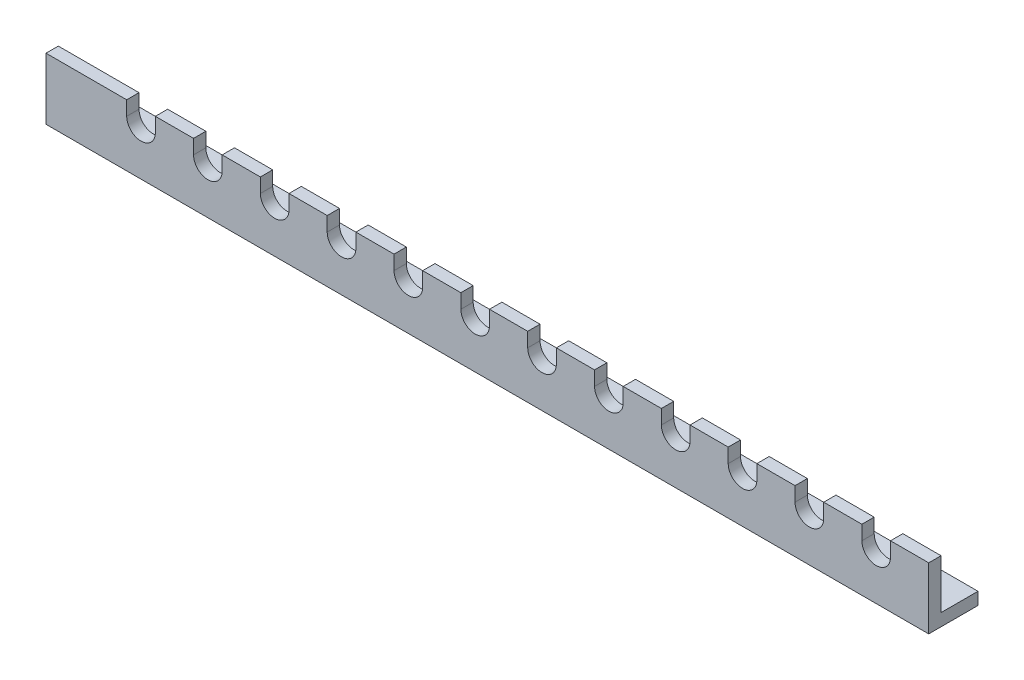
from build123d import *

# Parameters (mm, degrees)
BOSS_EXTRUDE1_DEPTH = 4
SKETCH3_W           = 286.6
SKETCH3_H           = 12
BOSS_EXTRUDE2_DEPTH = 4
CUT_EXTRUDE1_REACH  = 258.811
SKETCH4_R           = 1.55


with BuildPart() as part:
    # Sketch1 → Boss-Extrude1 (new body)
    with BuildSketch(Plane.XY):
        with BuildLine():
            Line((-4.65, 0), (-4.65, 4.65))
            Line((-4.65, 4.65), (-30.85, 4.65))
            Line((-30.85, 4.65), (-30.85, -15.35))
            Line((-30.85, -15.35), (255.75, -15.35))
            Line((255.75, -15.35), (255.75, 4.65))
            Line((255.75, 4.65), (243.35, 4.65))
            Line((243.35, 4.65), (243.35, 0))
            ThreePointArc((243.35, 0), (238.7, -4.65), (234.05, 0))
            Line((234.05, 0), (234.05, 4.65))
            Line((234.05, 4.65), (221.65, 4.65))
            Line((221.65, 4.65), (221.65, 0))
            ThreePointArc((221.65, 0), (217, -4.65), (212.35, 0))
            Line((212.35, 0), (212.35, 4.65))
            Line((212.35, 4.65), (199.95, 4.65))
            Line((199.95, 4.65), (199.95, 0))
            ThreePointArc((199.95, 0), (195.3, -4.65), (190.65, 0))
            Line((190.65, 0), (190.65, 4.65))
            Line((190.65, 4.65), (178.25, 4.65))
            Line((178.25, 4.65), (178.25, 0))
            ThreePointArc((178.25, 0), (173.6, -4.65), (168.95, 0))
            Line((168.95, 0), (168.95, 4.65))
            Line((168.95, 4.65), (156.55, 4.65))
            Line((156.55, 4.65), (156.55, 0))
            ThreePointArc((156.55, 0), (151.9, -4.65), (147.25, 0))
            Line((147.25, 0), (147.25, 4.65))
            Line((147.25, 4.65), (134.85, 4.65))
            Line((134.85, 4.65), (134.85, 0))
            ThreePointArc((134.85, 0), (130.2, -4.65), (125.55, 0))
            Line((125.55, 0), (125.55, 4.65))
            Line((125.55, 4.65), (113.15, 4.65))
            Line((113.15, 4.65), (113.15, 0))
            ThreePointArc((113.15, 0), (108.5, -4.65), (103.85, 0))
            Line((103.85, 0), (103.85, 4.65))
            Line((103.85, 4.65), (91.45, 4.65))
            Line((91.45, 4.65), (91.45, 0))
            ThreePointArc((91.45, 0), (86.8, -4.65), (82.15, 0))
            Line((82.15, 0), (82.15, 4.65))
            Line((82.15, 4.65), (69.75, 4.65))
            Line((69.75, 4.65), (69.75, 0))
            ThreePointArc((69.75, 0), (65.1, -4.65), (60.45, 0))
            Line((60.45, 0), (60.45, 4.65))
            Line((60.45, 4.65), (48.05, 4.65))
            Line((48.05, 4.65), (48.05, 0))
            ThreePointArc((48.05, 0), (43.4, -4.65), (38.75, 0))
            Line((38.75, 0), (38.75, 4.65))
            Line((38.75, 4.65), (26.35, 4.65))
            Line((26.35, 4.65), (26.35, 0))
            ThreePointArc((26.35, 0), (21.7, -4.65), (17.05, 0))
            Line((17.05, 0), (17.05, 4.65))
            Line((17.05, 4.65), (4.65, 4.65))
            Line((4.65, 4.65), (4.65, 0))
            ThreePointArc((4.65, 0), (0, -4.65), (-4.65, 0))
        make_face()
    extrude(amount=BOSS_EXTRUDE1_DEPTH)

    # Sketch3 → Boss-Extrude2 (add)
    with BuildSketch(Plane.XZ.offset(15.35)):
        with Locations((112.45, -6)):
            Rectangle(SKETCH3_W, SKETCH3_H)
    extrude(amount=-BOSS_EXTRUDE2_DEPTH)

    # Sketch4 → Cut-Extrude1 (cut, up to next)
    with BuildSketch(Plane.XZ.offset(15.35), mode=Mode.PRIVATE) as cut_extrude1_sk1:
        with Locations((-23.35, -4)):
            Circle(SKETCH4_R)
    cut_extrude1_tool1 = extrude(cut_extrude1_sk1.sketch, amount=-CUT_EXTRUDE1_REACH, mode=Mode.PRIVATE) & part.part
    # Sketch4 → Cut-Extrude1 (cut, up to next)
    with BuildSketch(Plane.XZ.offset(15.35), mode=Mode.PRIVATE) as cut_extrude1_sk2:
        with Locations((248.25, -4)):
            Circle(SKETCH4_R)
    cut_extrude1_tool2 = extrude(cut_extrude1_sk2.sketch, amount=-CUT_EXTRUDE1_REACH, mode=Mode.PRIVATE) & part.part
    # Sketch4 → Cut-Extrude1 (cut, up to next)
    with BuildSketch(Plane.XZ.offset(15.35), mode=Mode.PRIVATE) as cut_extrude1_sk3:
        with Locations((-9.85, -4)):
            Circle(SKETCH4_R)
    cut_extrude1_tool3 = extrude(cut_extrude1_sk3.sketch, amount=-CUT_EXTRUDE1_REACH, mode=Mode.PRIVATE) & part.part
    add(cut_extrude1_tool1.solids().sort_by_distance((-23.35, -15.35, -4))[0], mode=Mode.SUBTRACT)
    add(cut_extrude1_tool2.solids().sort_by_distance((248.25, -15.35, -4))[0], mode=Mode.SUBTRACT)
    add(cut_extrude1_tool3.solids().sort_by_distance((-9.85, -15.35, -4))[0], mode=Mode.SUBTRACT)


solid = part.part
